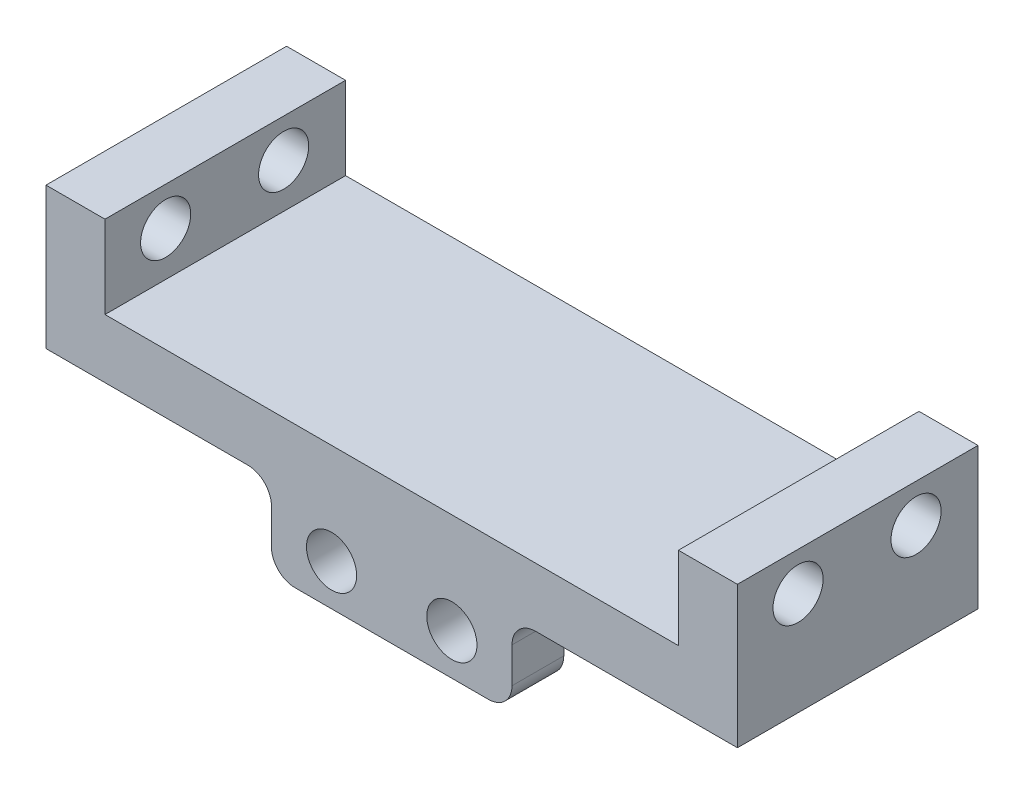
from build123d import *

# Parameters (mm, degrees)
SKETCH1_W                  = 58.6
SKETCH1_H                  = 20.38979341
BRACKETBASE_DEPTH          = 5
SKETCH2_W                  = 20.38979341
SKETCH2_H                  = 12
LEGMOUNTINGTAB_DEPTH       = 5
SKETCH3_R                  = 2.125
LEGMOUNTINGHOLES_DEPTH     = 5
SKETCH4_W                  = 20.38979341
SKETCH4_H                  = 7
ARDUINOMOUNTINGTAB_DEPTH   = 4.38979341
SKETCH5_R                  = 2.125
ARDUINOMOUNTINGHOLES_DEPTH = 5
FILLET1_R                  = 2


with BuildPart() as part:
    # Sketch1 → bracketBase (new body)
    with BuildSketch(Plane(origin=(0, 0, 0), x_dir=(1, 0, 0), z_dir=(0, 1, 0))):
        with Locations((29.3, 10.194896705)):
            Rectangle(SKETCH1_W, SKETCH1_H)
    extrude(amount=BRACKETBASE_DEPTH)

    # Sketch2 → legMountingTab (add)
    with BuildSketch(Plane.ZY):
        with Locations((-10.194896705, 6)):
            Rectangle(SKETCH2_W, SKETCH2_H)
    legmountingtab = extrude(amount=-LEGMOUNTINGTAB_DEPTH)

    # Sketch3 → legMountingHoles (cut)
    with BuildSketch(Plane(origin=(5, 0, 0), x_dir=(0, 0, -1), z_dir=(1, 0, 0))):
        with Locations((15.13979341, 8.75)):
            Circle(SKETCH3_R)
        with Locations((5.13979341, 8.75)):
            Circle(SKETCH3_R)
    legmountingholes = extrude(amount=-LEGMOUNTINGHOLES_DEPTH, mode=Mode.SUBTRACT)

    # legMountingHoles2: legMountingTab, legMountingHoles across plane
    add(legmountingtab.mirror(Plane.ZY.offset(-29.3)))
    add(legmountingholes.mirror(Plane.ZY.offset(-29.3)), mode=Mode.SUBTRACT)

    # Sketch4 → arduinoMountingTab (add)
    with BuildSketch(Plane.XY):
        with Locations((29.3, -3.5)):
            Rectangle(SKETCH4_W, SKETCH4_H)
    extrude(amount=-ARDUINOMOUNTINGTAB_DEPTH)

    # Sketch5 → arduinoMountingHoles (cut)
    with BuildSketch(Plane.XY):
        with Locations((34.397448352, -3.5)):
            Circle(SKETCH5_R)
        with Locations(Location((24.202551647, -3.5, 0), (0, 0, 180))):
            Circle(SKETCH5_R)
    extrude(amount=-ARDUINOMOUNTINGHOLES_DEPTH, mode=Mode.SUBTRACT)

    # Fillet1
    fillet1_edges = [part.edges().sort_by_distance(p)[0] for p in [
        (39.494896705, 0, -2.194896705),
        (39.494896705, -7, -2.194896705),
        (19.105103295, -7, -2.194896705),
        (19.105103295, 0, -2.194896705),
    ]]
    fillet(fillet1_edges, radius=FILLET1_R)


solid = part.part
